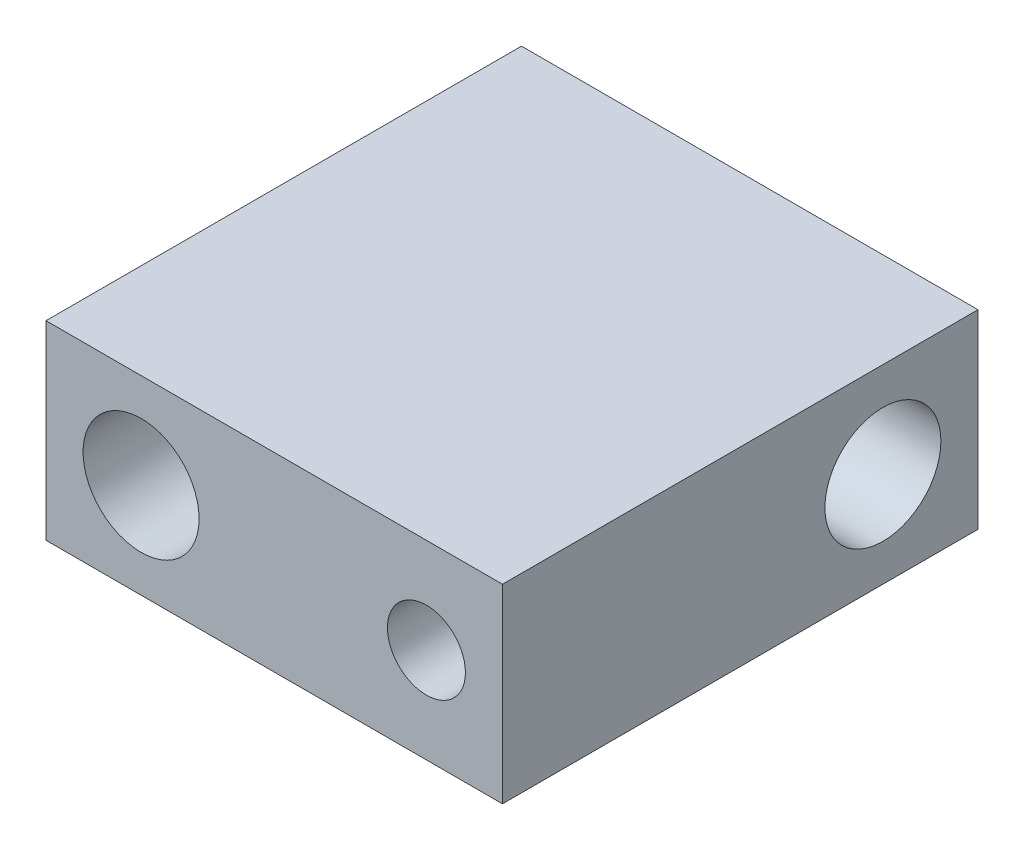
from build123d import *

# Parameters (mm, degrees)
SKETCH1_W           = 48
SKETCH1_H           = 20
SKETCH1_R           = 6.1
SKETCH1_R_2         = 4.1
BOSS_EXTRUDE1_DEPTH = 30
SKETCH2_W           = 48
SKETCH2_H           = 20
BOSS_EXTRUDE2_DEPTH = 20
SKETCH3_R           = 6.1
CUT_EXTRUDE1_DEPTH  = 40


with BuildPart() as part:
    # Sketch1 → Boss-Extrude1 (new body)
    with BuildSketch(Plane.XY):
        Rectangle(SKETCH1_W, SKETCH1_H)
        with Locations((-14, 0)):
            Circle(SKETCH1_R, mode=Mode.SUBTRACT)
        with Locations((16, 0)):
            Circle(SKETCH1_R_2, mode=Mode.SUBTRACT)
    extrude(amount=BOSS_EXTRUDE1_DEPTH)

    # Sketch2 → Boss-Extrude2 (add)
    with BuildSketch(Plane(origin=(0, 0, 0), x_dir=(-1, 0, 0), z_dir=(0, 0, -1))):
        Rectangle(SKETCH2_W, SKETCH2_H)
    extrude(amount=BOSS_EXTRUDE2_DEPTH)

    # Sketch3 → Cut-Extrude1 (cut)
    with BuildSketch(Plane(origin=(24, 0, 0), x_dir=(0, 0, -1), z_dir=(1, 0, 0))):
        with Locations((10, 0)):
            Circle(SKETCH3_R)
    extrude(amount=-CUT_EXTRUDE1_DEPTH, mode=Mode.SUBTRACT)


solid = part.part
